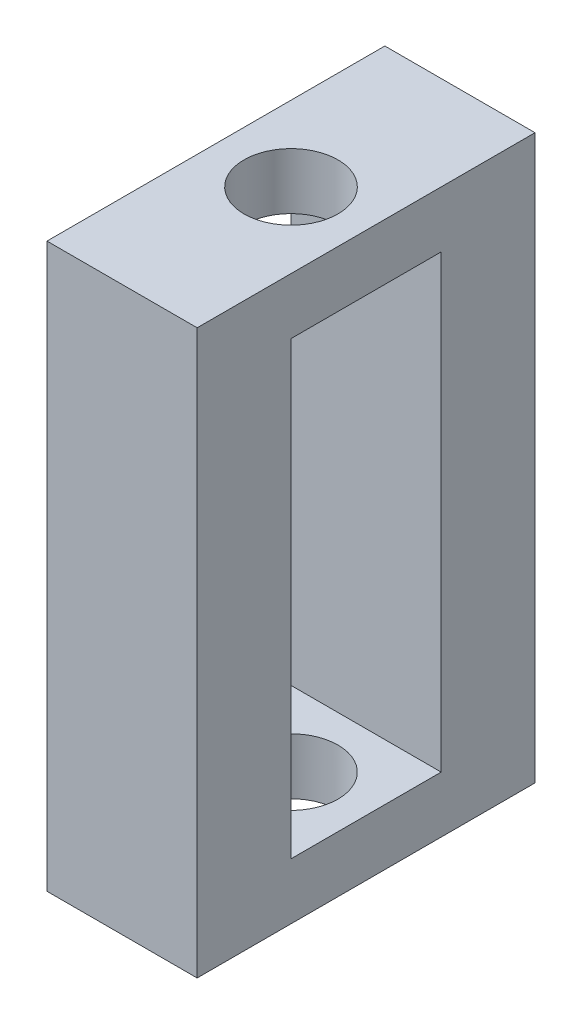
from build123d import *

# Parameters (mm, degrees)
SKETCH2_W           = 8
SKETCH2_H           = 18
BOSS_EXTRUDE1_DEPTH = 30
SKETCH3_R           = 2.5
CUT_EXTRUDE1_DEPTH  = 30
SKETCH5_W           = 8
SKETCH5_H           = 24
CUT_EXTRUDE2_DEPTH  = 30


with BuildPart() as part:
    # Sketch2 → Boss-Extrude1 (new body)
    with BuildSketch(Plane(origin=(0, 0, 0), x_dir=(1, 0, 0), z_dir=(0, 1, 0))):
        with Locations((4, 9)):
            Rectangle(SKETCH2_W, SKETCH2_H)
    extrude(amount=BOSS_EXTRUDE1_DEPTH)

    # Sketch3 → Cut-Extrude1 (cut)
    with BuildSketch(Plane(origin=(0, 30, 0), x_dir=(1, 0, 0), z_dir=(0, 1, 0))):
        with Locations(Location((4, 9, 0), (0, 0, 270))):
            Circle(SKETCH3_R)
    extrude(amount=-CUT_EXTRUDE1_DEPTH, mode=Mode.SUBTRACT)

    # Sketch5 → Cut-Extrude2 (cut)
    with BuildSketch(Plane(origin=(8, 0, 0), x_dir=(0, 0, -1), z_dir=(1, 0, 0))):
        with Locations((9, 15)):
            Rectangle(SKETCH5_W, SKETCH5_H)
    extrude(amount=-CUT_EXTRUDE2_DEPTH, mode=Mode.SUBTRACT)


solid = part.part
